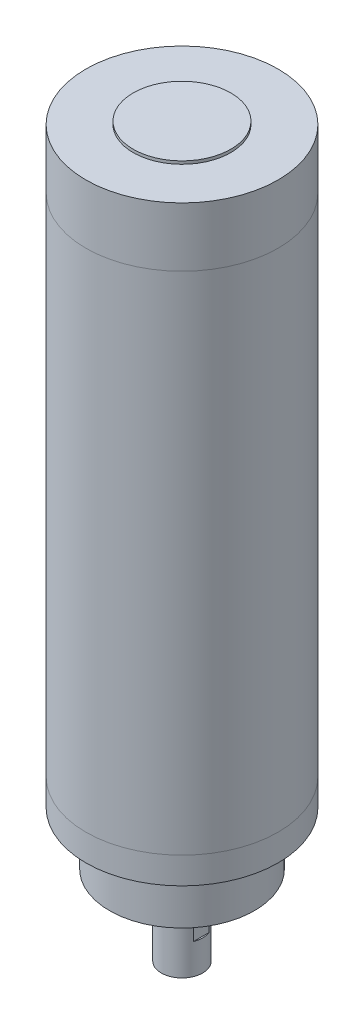
from build123d import *

# Parameters (mm, degrees)
SKETCH_1_R          = 32.5
EXTRUDE_1_DEPTH     = 171
SKETCH_7_W          = 14.75
SKETCH_7_H          = 2.5
SKETCH_9_W          = 0.5
SKETCH_9_H          = 8.2
CUT_EXTRUDE_1_DEPTH = 198.424669178
CHAMFER_1_SIZE      = 0.5
CHAMFER_1_SIZE2     = 0.587478506


with BuildPart() as part:
    # Эскиз1 → Бобышка-Вытянуть1 (new body)
    with BuildSketch(Plane(origin=(0, 0, 0), x_dir=(1, 0, 0), z_dir=(0, 1, 0))):
        with Locations(Location((0, 0, 0), (0, 0, 270))):
            Circle(SKETCH_1_R)
    extrude(amount=EXTRUDE_1_DEPTH)


with BuildPart() as body_2:
    # Эскиз6 → Повернуть1 (revolve)
    with BuildSketch(Plane.XY, mode=Mode.PRIVATE) as revolve_1_sk:
        Polygon((0, 0), (0, -27), (24.5, -27), (24.5, -9), (32.5, -9), (32.5, 0), align=None)
        Polygon((0, 171), (0, 192), (16.5, 192), (16.5, 191), (32.5, 191), (32.5, 171), align=None)
    revolve(revolve_1_sk.sketch.rotate(Axis((0, 0, 0), (0, -1, 0)), 180), axis=Axis((0, 0, 0), (0, -1, 0)))

    # Эскиз7 → Повернуть2 (revolve)
    with BuildSketch(Plane.XY, mode=Mode.PRIVATE) as revolve_2_sk:
        with Locations((7.375, -28.25)):
            Rectangle(SKETCH_7_W, SKETCH_7_H)
    revolve(revolve_2_sk.sketch.rotate(Axis((0, -27, 0), (0, -1, 0)), 180), axis=Axis((0, -27, 0), (0, -1, 0)))


with BuildPart() as body_3:
    # Эскиз8 → Повернуть3 (revolve)
    with BuildSketch(Plane.XY):
        Polygon((7.5, -29.5), (7.5, -32), (7, -32), (7, -54), (5.5, -54), (3.602698732, -40.5), (0, -40.5), (0, -29.5), align=None)
    revolve(axis=Axis((0, -40.5, 0), (0, 1, 0)))

    # Эскиз9 → Вырез-Вытянуть1 (cut, symmetric)
    with BuildSketch(Plane.XY):
        with Locations((6.75, -39.6)):
            Rectangle(SKETCH_9_W, SKETCH_9_H)
    cut_extrude_1 = extrude(amount=CUT_EXTRUDE_1_DEPTH, both=True, mode=Mode.SUBTRACT)

    # Зеркальное отражение1: Вырез-Вытянуть1 across plane
    add(cut_extrude_1.mirror(Plane(origin=(0, 0, 0), x_dir=(0, 0, 1), z_dir=(1, 0, 0))), mode=Mode.SUBTRACT)

    # Фаска1
    chamfer_1_edges = [body_3.edges().sort_by_distance(p)[0] for p in [
        (-5.5, -54, 0),
    ]]
    chamfer_1_side = [body_3.faces().sort_by_distance(p)[0] for p in [
        (-6.802010101, -54, 0),
    ]]
    chamfer(chamfer_1_edges, length=CHAMFER_1_SIZE, length2=CHAMFER_1_SIZE2, reference=chamfer_1_side[0])


solid = Compound([part.part, body_2.part, body_3.part])
